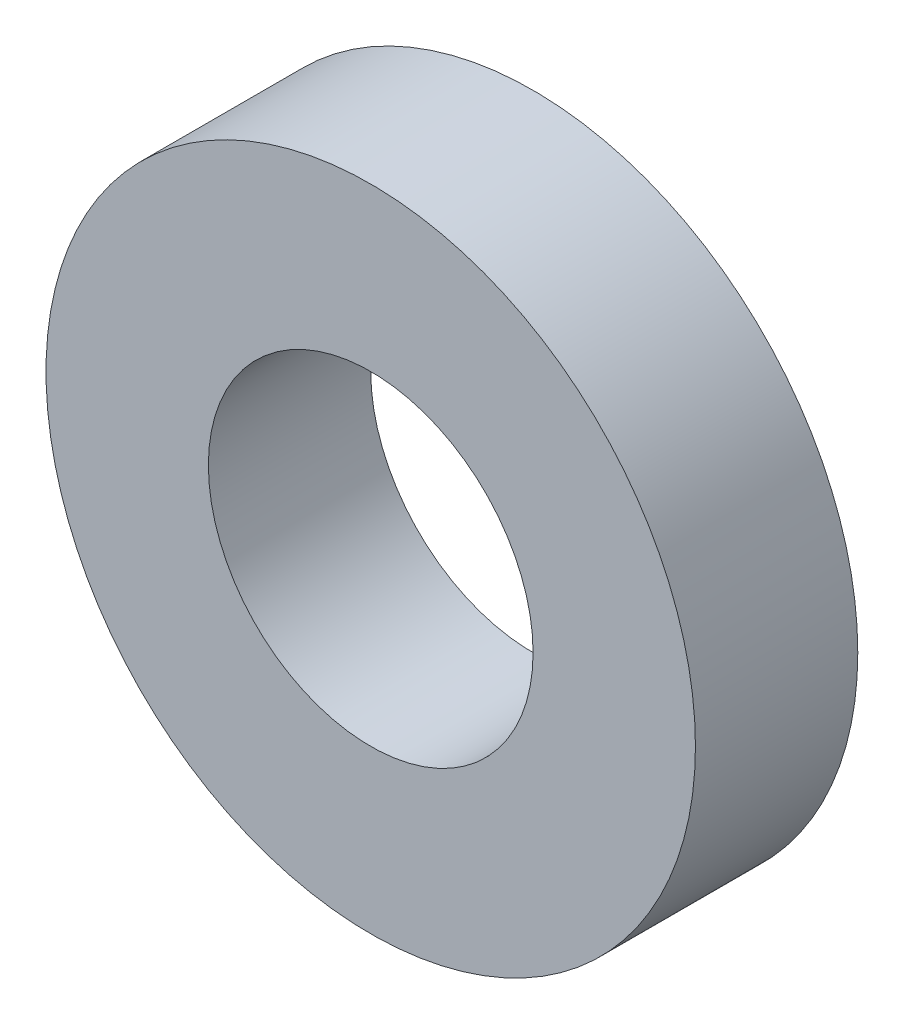
from build123d import *

# Parameters (mm, degrees)
SKETCH_1_R      = 10
SKETCH_1_R_2    = 5
EXTRUDE_1_DEPTH = 5


with BuildPart() as part:
    # 草图1 → 凸台-拉伸1 (new body)
    with BuildSketch(Plane.XY):
        Circle(SKETCH_1_R)
        Circle(SKETCH_1_R_2, mode=Mode.SUBTRACT)
    extrude(amount=EXTRUDE_1_DEPTH)


solid = part.part
